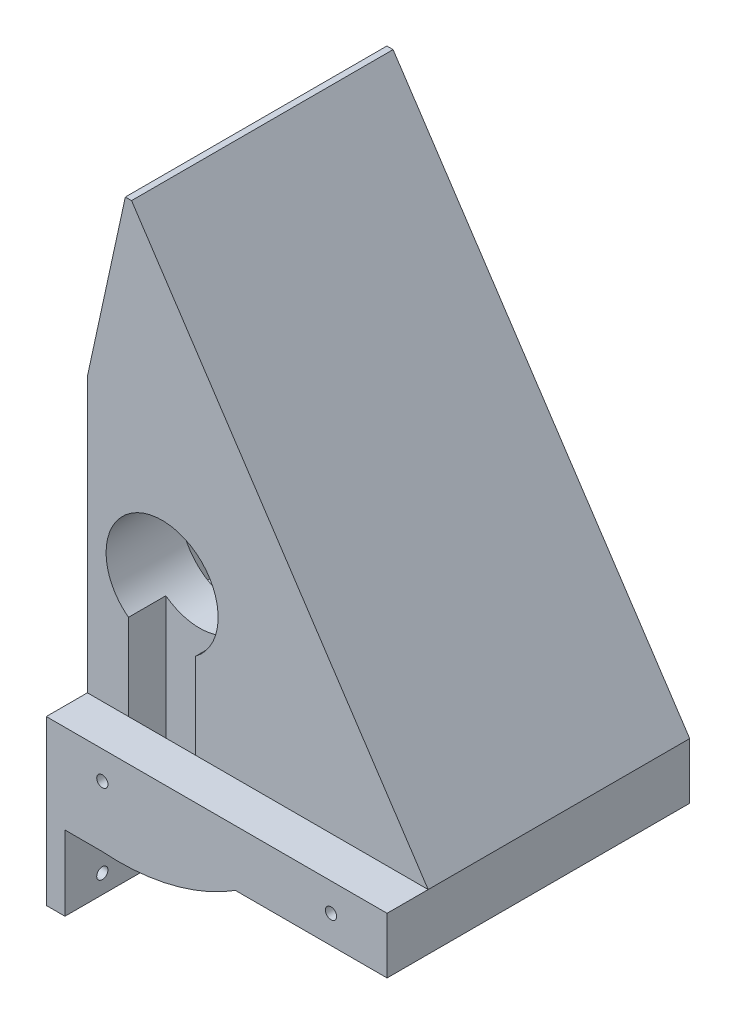
from build123d import *

# Parameters (mm, degrees)
EXTRUDE_1_DEPTH           = 30
EXTRUDE_2_DEPTH           = 210
SKETCH_8_W                = 25
SKETCH_8_H                = 120
EXTRUDE_5_DEPTH           = 70
SKETCH_9_W                = 25
SKETCH_9_H                = 60
EXTRUDE_6_DEPTH           = 60
SKETCH_10_R               = 7.5
CUT_EXTRUDE_3_DEPTH       = 402.372644808
EXTRUDE_7_DEPTH           = 60
EXTRUDE_8_REACH           = 392.16
SKETCH_12_R               = 2.5
SKETCH_14_W               = 125
SKETCH_14_H               = 50
EXTRUDE_9_DEPTH           = 120
SKETCH_15_W               = 70
SKETCH_15_H               = 70
CUT_EXTRUDE_4_DEPTH       = 10
CUT_EXTRUDE_5_DEPTH       = 20
SKETCH_17_R               = 43.471266984
CUT_EXTRUDE_6_DEPTH       = 428.317212384
EXTRUDE_10_DEPTH          = 20
EXTRUDE_11_DEPTH          = 20
CUT_EXTRUDE_7_DEPTH       = 434.012701892
CUT_EXTRUDE_8_DEPTH       = 434.012701892
EXTRUDE_19_REACH          = 446.86
EXTRUDE_20_DEPTH          = 20
EXTRUDE_21_DEPTH          = 20
EXTRUDE_START             = 20
EXTRUDE_22_DEPTH          = 20
CUT_EXTRUDE_9_DEPTH       = 30
CUT_EXTRUDE_11_DEPTH      = 407.201920232
CUT_EXTRUDE_11_DEPTH_BACK = 407.201920232
SKETCH_29_R               = 15
EXTRUDE_23_DEPTH          = 78.203243
SKETCH_33_W               = 30
SKETCH_33_H               = 40
CUT_EXTRUDE_14_DEPTH      = 20
SKETCH_34_W               = 18
SKETCH_34_H               = 35.300600551
CUT_EXTRUDE_15_DEPTH      = 10
CUT_EXTRUDE_16_DEPTH      = 10
SKETCH_36_RX              = 24.05
SKETCH_36_RY              = 15.9
SKETCH_36_R               = 15.9
CUT_EXTRUDE_17_DEPTH      = 4
SKETCH_37_W               = 148.788525811
SKETCH_37_H               = 80
CUT_EXTRUDE_18_DEPTH      = 445.859528391
SKETCH_38_W               = 76.211474189
SKETCH_38_H               = 51.3
CUT_EXTRUDE_20_DEPTH      = 80
CUT_EXTRUDE_START         = -81
CUT_EXTRUDE_21_DEPTH      = 81
CUT_EXTRUDE_22_DEPTH      = 402.372644808
SKETCH_41_W               = 18
SKETCH_41_H               = 10
CUT_EXTRUDE_23_DEPTH      = 60
SKETCH_44_W               = 50
SKETCH_44_H               = 109
EXTRUDE_26_DEPTH          = 15
SKETCH_45_W               = 50
SKETCH_45_H               = 109
EXTRUDE_27_DEPTH          = 15
EXTRUDE_28_DEPTH          = 15
SKETCH_47_W               = 15
SKETCH_47_H               = 50.339258453
CUT_EXTRUDE_24_DEPTH      = 109
CUT_EXTRUDE_27_DEPTH      = 400.249295554
CUT_EXTRUDE_27_DEPTH_BACK = 400.249295554
CUT_EXTRUDE_28_DEPTH      = 435.539986653
CUT_EXTRUDE_28_DEPTH_BACK = 435.539986653
CUT_EXTRUDE_29_DEPTH      = 323.795419456
CUT_EXTRUDE_29_DEPTH_BACK = 15
SKETCH_56_W               = 81
SKETCH_56_H               = 139.588324269
SKETCH_57_W               = 5
SKETCH_57_H               = 81
EXTRUDE_30_DEPTH          = 20
SKETCH_58_R               = 1.5
CUT_EXTRUDE_30_DEPTH      = 20
SKETCH_59_R               = 1.5
CUT_EXTRUDE_31_DEPTH      = 10


with BuildPart() as part:
    # 草图1 → 凸台-拉伸1 (new body)
    with BuildSketch(Plane(origin=(0, 0, 0), x_dir=(0, 0, -1), z_dir=(1, 0, 0))):
        with BuildLine():
            Line((0, 0), (270, 0))
            Line((270, 0), (270, -100.282814983))
            ThreePointArc((270, -100.282814983), (264.178138298, -118.691056762), (248.830033233, -130.404003019))
            Line((248.830033233, -130.404003019), (142.45524498, -168.69892679))
            ThreePointArc((142.45524498, -168.69892679), (135, -170), (127.54475502, -168.69892679))
            Line((127.54475502, -168.69892679), (21.169966767, -130.404003019))
            ThreePointArc((21.169966767, -130.404003019), (5.821861702, -118.691056762), (0, -100.282814983))
            Line((0, -100.282814983), (0, 0))
        make_face()
    extrude(amount=EXTRUDE_1_DEPTH)

    # 草图2 → 凸台-拉伸2 (add)
    with BuildSketch(Plane(origin=(30, 0, 0), x_dir=(0, 0, -1), z_dir=(1, 0, 0))):
        with BuildLine():
            Line((105, -160.582814983), (105, 0))
            Line((105, 0), (0, 0))
            Line((0, 0), (0, -100.282814983))
            ThreePointArc((0, -100.282814983), (5.821861702, -118.691056762), (21.169966767, -130.404003019))
            Line((21.169966767, -130.404003019), (105, -160.582814983))
        make_face()
        with BuildLine():
            Line((270, 0), (165, 0))
            Line((165, 0), (165, -160.582814983))
            Line((165, -160.582814983), (248.830033233, -130.404003019))
            ThreePointArc((248.830033233, -130.404003019), (264.178138298, -118.691056762), (270, -100.282814983))
            Line((270, -100.282814983), (270, 0))
        make_face()
    extrude(amount=EXTRUDE_2_DEPTH)

    # 草图8 → 凸台-拉伸5 (add)
    with BuildSketch(Plane(origin=(240, 0, 0), x_dir=(0, 0, -1), z_dir=(1, 0, 0))):
        with Locations((92.5, 0)):
            Rectangle(SKETCH_8_W, SKETCH_8_H)
        with Locations((177.5, 0)):
            Rectangle(SKETCH_8_W, SKETCH_8_H)
    extrude(amount=EXTRUDE_5_DEPTH)

    # 草图9 → 凸台-拉伸6 (add)
    with BuildSketch(Plane.ZY.offset(-240)):
        with Locations((-92.5, 30)):
            Rectangle(SKETCH_9_W, SKETCH_9_H)
        with Locations((-177.5, 30)):
            Rectangle(SKETCH_9_W, SKETCH_9_H)
    extrude(amount=EXTRUDE_6_DEPTH)

    # 草图10 → 切除-拉伸3 (cut, through all)
    with BuildSketch(Plane.XY.offset(-80)):
        with Locations((270, 30)):
            Circle(SKETCH_10_R)
    extrude(amount=-CUT_EXTRUDE_3_DEPTH, mode=Mode.SUBTRACT)

    # 草图11 → 凸台-拉伸7 (add)
    with BuildSketch(Plane(origin=(0, 0, -105), x_dir=(-1, 0, 0), z_dir=(0, 0, -1))):
        with BuildLine():
            Line((-30, -40), (-30, -160.582814983))
            Line((-30, -160.582814983), (-108.203242822, -160.582814983))
            ThreePointArc((-108.203242822, -160.582814983), (-60.24964282, -106.032303748), (-30, -40))
        make_face()
    extrude(amount=EXTRUDE_7_DEPTH)

    # 草图12 → 凸台-拉伸8 (add, up to next)
    with BuildSketch(Plane.XY.offset(-165), mode=Mode.PRIVATE) as extrude_8_sk1:
        with Locations(Location((70, -45, 0), (0, 0, 180))):
            Circle(SKETCH_12_R)
    extrude_8_tool1 = extrude(extrude_8_sk1.sketch, amount=EXTRUDE_8_REACH, mode=Mode.PRIVATE) - part.part
    add(extrude_8_tool1.solids().sort_by_distance((70, -45, -165))[0])

    # 草图14 → 凸台-拉伸9 (add)
    with BuildSketch(Plane(origin=(0, 0, 0), x_dir=(1, 0, 0), z_dir=(0, 1, 0))):
        with Locations((62.5, 225)):
            Rectangle(SKETCH_14_W, SKETCH_14_H)
        with Locations((62.5, 45)):
            Rectangle(SKETCH_14_W, SKETCH_14_H)
    extrude(amount=EXTRUDE_9_DEPTH)

    # 草图15 → 切除-拉伸4 (cut)
    with BuildSketch(Plane.XY.offset(-20)):
        with Locations((35, 35)):
            Rectangle(SKETCH_15_W, SKETCH_15_H)
    extrude(amount=-CUT_EXTRUDE_4_DEPTH, mode=Mode.SUBTRACT)

    # 草图16 → 切除-拉伸5 (cut)
    with BuildSketch(Plane.XY.offset(-30)):
        Polygon((35, 15), (5, 15), (5, 55), (35, 55), (35, 35), align=None)
    extrude(amount=-CUT_EXTRUDE_5_DEPTH, mode=Mode.SUBTRACT)

    # 草图17 → 切除-拉伸6 (cut, through all)
    with BuildSketch(Plane.XY.offset(-30)):
        with Locations((19.5, 34.5)):
            Circle(SKETCH_17_R)
    extrude(amount=CUT_EXTRUDE_6_DEPTH, mode=Mode.SUBTRACT)

    # 草图18 → 凸台-拉伸10 (add)
    with BuildSketch(Plane.XY.offset(-20)):
        Polygon((11.819921283, 120), (91.211474189, 0), (87.317867735, 0), (10.741661946, 115.744614613), align=None)
    extrude(amount=EXTRUDE_10_DEPTH)

    # 草图19 → 凸台-拉伸11 (add)
    with BuildSketch(Plane.XY.offset(-20)):
        with BuildLine():
            Line((1.857343832, 74.230186717), (10.856035233, 115.571739869))
            Line((10.856035233, 115.571739869), (10.741661946, 115.744614613))
            Line((10.741661946, 115.744614613), (11.819921283, 120))
            Line((11.819921283, 120), (10.153664863, 120))
            Line((10.153664863, 120), (0, 73.352297914))
            ThreePointArc((0, 73.352297914), (0.923485284, 73.80221564), (1.857343832, 74.230186717))
        make_face()
    extrude(amount=EXTRUDE_11_DEPTH)

    # 草图20 → 切除-拉伸7 (cut, through all)
    with BuildSketch(Plane.XY.offset(-20)):
        Polygon((0, 120), (0, 73.352297914), (10.153664863, 120), align=None)
    extrude(amount=-CUT_EXTRUDE_7_DEPTH, mode=Mode.SUBTRACT)

    # 草图22 → 切除-拉伸8 (cut, through all)
    with BuildSketch(Plane.XY.offset(-20)):
        Polygon((44.899734993, 70), (70, 32.061054476), (91.211474189, 0), (125, 0), (125, 120), (11.819921283, 120), align=None)
    extrude(amount=-CUT_EXTRUDE_8_DEPTH, mode=Mode.SUBTRACT)

    # 草图23 → 凸台-拉伸19 (add, up to next)
    with BuildSketch(Plane.XY, mode=Mode.PRIVATE) as extrude_19_sk1:
        with BuildLine():
            Line((87.317867735, 0), (91.211474189, 0))
            Line((91.211474189, 0), (11.819921283, 120))
            Line((11.819921283, 120), (10.153664863, 120))
            Line((10.153664863, 120), (0, 73.352297914))
            ThreePointArc((0, 73.352297914), (0.923485284, 73.80221564), (1.857343832, 74.230186717))
            Line((1.857343832, 74.230186717), (10.856035233, 115.571739869))
            Line((10.856035233, 115.571739869), (87.317867735, 0))
        make_face()
    extrude_19_tool1 = extrude(extrude_19_sk1.sketch, amount=-EXTRUDE_19_REACH, mode=Mode.PRIVATE) - part.part
    add(extrude_19_tool1.solids().sort_by_distance((89.264671, 1.5073, 0))[0])

    # 草图24 → 凸台-拉伸20 (add)
    with BuildSketch(Plane.XY.offset(-20)):
        Polygon((87.317867735, 0), (70, 26.175884614), (70, 0), align=None)
    extrude(amount=EXTRUDE_20_DEPTH)

    # 草图25 → 凸台-拉伸21 (add)
    with BuildSketch(Plane.XY.offset(-20)):
        with BuildLine():
            Line((38.684579851, 73.509011127), (10.856035233, 115.571739869))
            Line((10.856035233, 115.571739869), (1.857343832, 74.230186717))
            ThreePointArc((1.857343832, 74.230186717), (20.351120273, 77.962934179), (38.684579851, 73.509011127))
        make_face()
    extrude(amount=EXTRUDE_21_DEPTH)

    # 草图26 → 凸台-拉伸22 (add)
    with BuildSketch(Plane(origin=(0, 0, -250), x_dir=(-1, 0, 0), z_dir=(0, 0, -1)).offset(EXTRUDE_START)):
        with BuildLine():
            Line((-70, 26.175884614), (-38.684579851, 73.509011127))
            ThreePointArc((-38.684579851, 73.509011127), (-19.323897117, 77.970910285), (0, 73.352297914))
            Line((0, 73.352297914), (-10.153664863, 120))
            Line((-10.153664863, 120), (-11.819921283, 120))
            Line((-11.819921283, 120), (-91.211474189, 0))
            Line((-91.211474189, 0), (-240, 0))
            Line((-240, 0), (-240, -100.282814983))
            Line((-240, -100.282814983), (0, -100.282814983))
            Line((0, -100.282814983), (0, -4.352297914))
            ThreePointArc((0, -4.352297914), (-23.599339693, -8.77755154), (-45.948082222, 0))
            Line((-45.948082222, 0), (-70, 0))
            Line((-70, 0), (-70, 26.175884614))
        make_face()
    extrude(amount=-EXTRUDE_22_DEPTH)

    # 草图27 → 切除-拉伸9 (cut)
    with BuildSketch(Plane(origin=(0, 0, -270), x_dir=(-1, 0, 0), z_dir=(0, 0, -1))):
        with BuildLine():
            Line((-38.684579851, 73.509011127), (-70, 26.175884614))
            Line((-70, 26.175884614), (-70, 0))
            Line((-70, 0), (-45.948082222, 0))
            ThreePointArc((-45.948082222, 0), (-23.599339693, -8.77755154), (0, -4.352297914))
            Line((0, -4.352297914), (0, 73.352297914))
            ThreePointArc((0, 73.352297914), (-19.323897117, 77.970910285), (-38.684579851, 73.509011127))
        make_face()
    extrude(amount=-CUT_EXTRUDE_9_DEPTH, mode=Mode.SUBTRACT)

    # 草图29 → 切除-拉伸11 (cut, two sides: drawn at the far end of the back side and taken through both)
    with BuildSketch(Plane(origin=(0, 0, -70), x_dir=(-1, 0, 0), z_dir=(0, 0, -1)).offset(-CUT_EXTRUDE_11_DEPTH_BACK)):
        with Locations((-20, 35)):
            Circle(SKETCH_29_R)
    extrude(amount=CUT_EXTRUDE_11_DEPTH + CUT_EXTRUDE_11_DEPTH_BACK, mode=Mode.SUBTRACT)

    # 草图30 → 凸台-拉伸23 (add)
    with BuildSketch(Plane(origin=(30, 0, 0), x_dir=(0, 0, -1), z_dir=(1, 0, 0))):
        with BuildLine():
            Line((142.45524498, -168.69892679), (165, -160.582814983))
            Line((165, -160.582814983), (105, -160.582814983))
            Line((105, -160.582814983), (127.54475502, -168.69892679))
            ThreePointArc((127.54475502, -168.69892679), (135, -170), (142.45524498, -168.69892679))
        make_face()
    extrude(amount=EXTRUDE_23_DEPTH)

    # 草图33 → 切除-拉伸14 (cut)
    with BuildSketch(Plane(origin=(0, 0, -240), x_dir=(-1, 0, 0), z_dir=(0, 0, -1))):
        with Locations((-20, 35)):
            Rectangle(SKETCH_33_W, SKETCH_33_H)
    extrude(amount=-CUT_EXTRUDE_14_DEPTH, mode=Mode.SUBTRACT)

    # 草图34 → 切除-拉伸15 (cut)
    with BuildSketch(Plane.XY.offset(-200)):
        with Locations((20, 17.650300276)):
            Rectangle(SKETCH_34_W, SKETCH_34_H)
    extrude(amount=-CUT_EXTRUDE_15_DEPTH, mode=Mode.SUBTRACT)

    # 草图35 → 切除-拉伸16 (cut)
    with BuildSketch(Plane(origin=(0, 0, -70), x_dir=(-1, 0, 0), z_dir=(0, 0, -1))):
        with BuildLine():
            Line((-11, 0), (-11, 23))
            ThreePointArc((-11, 23), (-20, 20), (-29, 23))
            Line((-29, 23), (-29, 0))
            Line((-29, 0), (-11, 0))
        make_face()
    extrude(amount=-CUT_EXTRUDE_16_DEPTH, mode=Mode.SUBTRACT)

    # 草图36 → 切除-拉伸17 (cut)
    # profile 1 of 6: a face of its own
    with BuildSketch(Plane.ZY):
        with Locations((-235.69166945, -100.008005659)):
            Ellipse(SKETCH_36_RX, SKETCH_36_RY)
        with Locations((-235.69166945, -100.008005659)):
            Circle(SKETCH_36_R, mode=Mode.SUBTRACT)
    # profile 2 of 6: a face of its own
    with BuildSketch(Plane.ZY):
        with Locations((-235.69166945, -100.008005659)):
            Ellipse(SKETCH_36_RX, SKETCH_36_RY)
        with Locations((-235.69166945, -100.008005659)):
            Circle(SKETCH_36_R, mode=Mode.SUBTRACT)
    # profile 3 of 6: a face of its own
    with BuildSketch(Plane.ZY):
        with Locations((-235.69166945, -100.008005659)):
            Circle(SKETCH_36_R)
    # profile 4 of 6: a face of its own
    with BuildSketch(Plane.ZY):
        with Locations(Location((-34.30833055, -100.008005659), (0, 0, 180))):
            Ellipse(SKETCH_36_RX, SKETCH_36_RY)
        with Locations((-34.30833055, -100.008005659)):
            Circle(SKETCH_36_R, mode=Mode.SUBTRACT)
    # profile 5 of 6: a face of its own
    with BuildSketch(Plane.ZY):
        with Locations(Location((-34.30833055, -100.008005659), (0, 0, 180))):
            Ellipse(SKETCH_36_RX, SKETCH_36_RY)
        with Locations((-34.30833055, -100.008005659)):
            Circle(SKETCH_36_R, mode=Mode.SUBTRACT)
    # profile 6 of 6: a face of its own
    with BuildSketch(Plane.ZY):
        with Locations((-34.30833055, -100.008005659)):
            Circle(SKETCH_36_R)
    extrude(amount=-CUT_EXTRUDE_17_DEPTH, mode=Mode.SUBTRACT)

    # 草图37 → 切除-拉伸18 (cut, through all)
    with BuildSketch(Plane(origin=(0, 0, 0), x_dir=(1, 0, 0), z_dir=(0, 1, 0))):
        with Locations((165.605737095, 40)):
            Rectangle(SKETCH_37_W, SKETCH_37_H)
        with Locations((165.605737095, 230)):
            Rectangle(SKETCH_37_W, SKETCH_37_H)
    extrude(amount=-CUT_EXTRUDE_18_DEPTH, mode=Mode.SUBTRACT)

    # 草图38 → 切除-拉伸20 (cut)
    with BuildSketch(Plane.XY):
        with Locations((53.105737095, -125.932814983)):
            Rectangle(SKETCH_38_W, SKETCH_38_H)
        Polygon((91.211474189, -15), (76.211474189, -15), (76.211474189, -85.282814983), (15, -85.282814983), (15, -100.282814983), (91.211474189, -100.282814983), align=None)
        with BuildLine():
            ThreePointArc((15, -23.79784784), (33.51949079, -22.265684535), (50.622966805, -15))
            Line((50.622966805, -15), (70, -15))
            Line((70, -15), (76.211474189, -15))
            Line((76.211474189, -15), (76.211474189, -85.282814983))
            Line((76.211474189, -85.282814983), (15, -85.282814983))
            Line((15, -85.282814983), (15, -23.79784784))
        make_face()
    extrude(amount=-CUT_EXTRUDE_20_DEPTH, mode=Mode.SUBTRACT)

    # 草图39 → 切除-拉伸21 (cut)
    with BuildSketch(Plane(origin=(0, 0, -270), x_dir=(-1, 0, 0), z_dir=(0, 0, -1)).offset(CUT_EXTRUDE_START)):
        with BuildLine():
            Line((-180, 60), (-310, 60))
            Line((-310, 60), (-310, -60))
            Line((-310, -60), (-240, -60))
            Line((-240, -60), (-240, -151.582814983))
            Line((-240, -151.582814983), (-15, -151.582814983))
            Line((-15, -151.582814983), (-15, -23.79784784))
            ThreePointArc((-15, -23.79784784), (-33.51949079, -22.265684535), (-50.622966805, -15))
            Line((-50.622966805, -15), (-91.211474189, -15))
            Line((-91.211474189, -15), (-91.211474189, 0))
            Line((-91.211474189, 0), (-180, 0))
            Line((-180, 0), (-180, 60))
        make_face()
    extrude(amount=CUT_EXTRUDE_21_DEPTH, mode=Mode.SUBTRACT)

    # 草图40 → 切除-拉伸22 (cut, through all)
    with BuildSketch(Plane.XY.offset(-80)):
        with BuildLine():
            Line((74.655848302, -141.582814983), (40, -141.582814983))
            Line((40, -141.582814983), (40, -91.24355653))
            ThreePointArc((40, -91.24355653), (55.843697078, -117.43499557), (74.655848302, -141.582814983))
        make_face()
    extrude(amount=-CUT_EXTRUDE_22_DEPTH, mode=Mode.SUBTRACT)

    # 草图41 → 切除-拉伸23 (cut)
    with BuildSketch(Plane(origin=(0, 0, 0), x_dir=(1, 0, 0), z_dir=(0, 1, 0))):
        with Locations((20, 65)):
            Rectangle(SKETCH_41_W, SKETCH_41_H)
        with Locations((20, 205)):
            Rectangle(SKETCH_41_W, SKETCH_41_H)
    extrude(amount=-CUT_EXTRUDE_23_DEPTH, mode=Mode.SUBTRACT)

    # 草图44 → 凸台-拉伸26 (add)
    with BuildSketch(Plane(origin=(0, 60, 0), x_dir=(1, 0, 0), z_dir=(0, 1, 0))):
        with Locations((285, 134.5)):
            Rectangle(SKETCH_44_W, SKETCH_44_H)
    extrude(amount=EXTRUDE_26_DEPTH)

    # 草图45 → 凸台-拉伸27 (add)
    with BuildSketch(Plane.XZ.offset(60)):
        with Locations((285, -134.5)):
            Rectangle(SKETCH_45_W, SKETCH_45_H)
    extrude(amount=EXTRUDE_27_DEPTH)

    # 草图46 → 凸台-拉伸28 (add)
    with BuildSketch(Plane(origin=(240, 0, 0), x_dir=(0, 0, -1), z_dir=(1, 0, 0))):
        Polygon((80, -151.582814983), (105, -160.582814983), (165, -160.582814983), (189, -151.942814983), (189, -130.582814983), (80, -130.582814983), align=None)
    extrude(amount=EXTRUDE_28_DEPTH)

    # 草图47 → 切除-拉伸24 (cut)
    with BuildSketch(Plane(origin=(0, 0, -189), x_dir=(-1, 0, 0), z_dir=(0, 0, -1))):
        with Locations((-32.5, -116.413185757)):
            Rectangle(SKETCH_47_W, SKETCH_47_H)
    extrude(amount=-CUT_EXTRUDE_24_DEPTH, mode=Mode.SUBTRACT)

    # 草图51 → 切除-拉伸27 (cut, two sides: drawn at the far end of the back side and taken through both)
    with BuildSketch(Plane(origin=(240, 0, 0), x_dir=(0, 0, -1), z_dir=(1, 0, 0)).offset(-CUT_EXTRUDE_27_DEPTH_BACK)):
        Polygon((190, -151.582814983), (189, -151.582814983), (189, -151.942814983), align=None)
    extrude(amount=CUT_EXTRUDE_27_DEPTH + CUT_EXTRUDE_27_DEPTH_BACK, mode=Mode.SUBTRACT)

    # 草图48 → 切除-拉伸28 (cut, two sides: drawn at the far end of the back side and taken through both)
    with BuildSketch(Plane(origin=(15, 0, 0), x_dir=(0, 0, -1), z_dir=(1, 0, 0)).offset(-CUT_EXTRUDE_28_DEPTH_BACK)):
        Polygon((0, 72.29617301), (70, 73.297590414), (70, 120), (0, 120), align=None)
        Polygon((70, 73.297590414), (189, 75), (189, 120), (70, 120), align=None)
        Polygon((70, 0), (70, 73.297590414), (0, 72.29617301), (0, 0), align=None)
        with BuildLine():
            Line((189, -151.582814983), (189, -23.79784784))
            Line((189, -23.79784784), (189, 75))
            Line((189, 75), (70, 73.297590414))
            Line((70, 73.297590414), (70, 0))
            Line((70, 0), (0, 0))
            Line((0, 0), (0, -23.79784784))
            Line((0, -23.79784784), (60, -23.79784784))
            Line((60, -23.79784784), (60, -60))
            Line((60, -60), (70, -60))
            Line((70, -60), (70, -23.79784784))
            Line((70, -23.79784784), (80, -23.79784784))
            Line((80, -23.79784784), (80, -151.582814983))
            Line((80, -151.582814983), (21.169966767, -130.404003019))
            ThreePointArc((21.169966767, -130.404003019), (5.821861702, -118.691056762), (0, -100.282814983))
            Line((0, -100.282814983), (0, -180.746423956))
            Line((0, -180.746423956), (189, -180.746423956))
            Line((189, -180.746423956), (189, -151.582814983))
        make_face()
        with BuildLine():
            Line((0, -23.79784784), (0, -100.282814983))
            ThreePointArc((0, -100.282814983), (5.821861702, -118.691056762), (21.169966767, -130.404003019))
            Line((21.169966767, -130.404003019), (80, -151.582814983))
            Line((80, -151.582814983), (80, -23.79784784))
            Line((80, -23.79784784), (70, -23.79784784))
            Line((70, -23.79784784), (70, -60))
            Line((70, -60), (60, -60))
            Line((60, -60), (60, -23.79784784))
            Line((60, -23.79784784), (0, -23.79784784))
        make_face()
    extrude(amount=CUT_EXTRUDE_28_DEPTH + CUT_EXTRUDE_28_DEPTH_BACK, mode=Mode.SUBTRACT)

    # 草图56 → 切除-拉伸29 (cut, two sides: drawn at the far end of the back side and taken through both)
    with BuildSketch(Plane.ZY.offset(-CUT_EXTRUDE_29_DEPTH_BACK)):
        with Locations((-229.5, -93.592009975)):
            Rectangle(SKETCH_56_W, SKETCH_56_H)
    extrude(amount=CUT_EXTRUDE_29_DEPTH + CUT_EXTRUDE_29_DEPTH_BACK, mode=Mode.SUBTRACT)

    # 草图57 → 凸台-拉伸30 (add)
    with BuildSketch(Plane.XZ.offset(23.79784784)):
        with Locations((2.5, -229.5)):
            Rectangle(SKETCH_57_W, SKETCH_57_H)
    extrude(amount=EXTRUDE_30_DEPTH)

    # 草图58 → 切除-拉伸30 (cut)
    with BuildSketch(Plane(origin=(5, 0, 0), x_dir=(0, 0, -1), z_dir=(1, 0, 0))):
        with Locations((260, -38.79784784)):
            Circle(SKETCH_58_R)
        with Locations((199, -38.79784784)):
            Circle(SKETCH_58_R)
    extrude(amount=-CUT_EXTRUDE_30_DEPTH, mode=Mode.SUBTRACT)

    # 草图59 → 切除-拉伸31 (cut)
    with BuildSketch(Plane.XY.offset(-189)):
        with Locations((15, -7.5)):
            Circle(SKETCH_59_R)
        with Locations((76.211474189, -7.5)):
            Circle(SKETCH_59_R)
    extrude(amount=-CUT_EXTRUDE_31_DEPTH, mode=Mode.SUBTRACT)


solid = part.part
